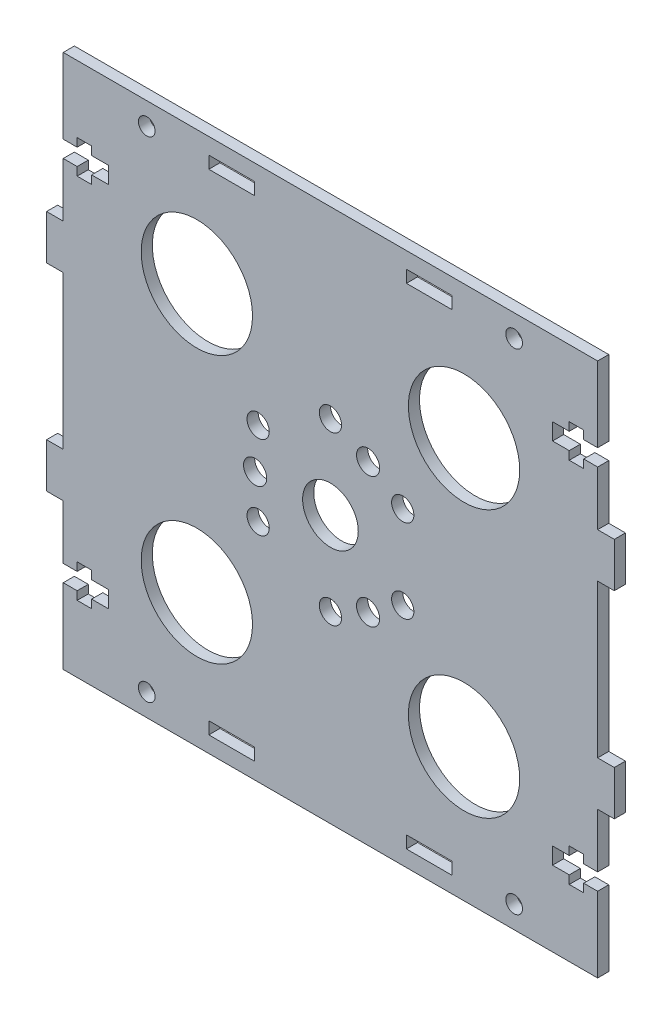
from build123d import *

# Parameters (mm, degrees)
SKETCH_1_R      = 1.5
SKETCH_1_R_2    = 2
SKETCH_1_R_3    = 2.08
SKETCH_1_R_4    = 5
SKETCH_1_R_5    = 10
SKETCH_1_W      = 8.2
SKETCH_1_H      = 2.2
EXTRUDE_1_DEPTH = 2


with BuildPart() as part:
    # 草图1 → 凸台-拉伸1 (new body)
    with BuildSketch(Plane.XY):
        Polygon((-50.266155614, -92.324512395), (-50.266155614, -102.074512395), (-47.766155614, -102.074512395), (-47.766155614, -100.574512395), (-45.166155614, -100.574512395), (-45.166155614, -102.074512395), (-42.166155614, -102.074512395), (-42.166155614, -105.074512395), (-45.166155614, -105.074512395), (-45.166155614, -106.574512395), (-47.766155614, -106.574512395), (-47.766155614, -105.074512395), (-50.266155614, -105.074512395), (-50.266155614, -106.074512395), (-50.266155614, -118.574512395), (-2.266155614, -118.574512395), (45.733844386, -118.574512395), (45.733844386, -106.074512395), (45.733844386, -105.074512395), (43.233844386, -105.074512395), (43.233844386, -106.574512395), (40.633844386, -106.574512395), (40.633844386, -105.074512395), (37.633844386, -105.074512395), (37.633844386, -102.074512395), (40.633844386, -102.074512395), (40.633844386, -100.574512395), (43.233844386, -100.574512395), (43.233844386, -102.074512395), (45.733844386, -102.074512395), (45.733844386, -92.324512395), (48.733844386, -92.324512395), (48.733844386, -84.324512395), (45.733844386, -84.324512395), (45.733844386, -56.824512395), (48.733844386, -56.824512395), (48.733844386, -48.824512395), (45.733844386, -48.824512395), (45.733844386, -39.074512395), (43.233844386, -39.074512395), (43.233844386, -40.574512395), (40.633844386, -40.574512395), (40.633844386, -39.074512395), (37.633844386, -39.074512395), (37.633844386, -36.074512395), (40.633844386, -36.074512395), (40.633844386, -34.574512395), (43.233844386, -34.574512395), (43.233844386, -36.074512395), (45.733844386, -36.074512395), (45.733844386, -23.574512395), (45.733844386, -22.574512395), (-2.266155614, -22.574512395), (-50.266155614, -22.574512395), (-50.266155614, -23.574512395), (-50.266155614, -36.074512395), (-47.766155614, -36.074512395), (-47.766155614, -34.574512395), (-45.166155614, -34.574512395), (-45.166155614, -36.074512395), (-42.166155614, -36.074512395), (-42.166155614, -39.074512395), (-45.166155614, -39.074512395), (-45.166155614, -40.574512395), (-47.766155614, -40.574512395), (-47.766155614, -39.074512395), (-50.266155614, -39.074512395), (-50.266155614, -48.824512395), (-53.266155614, -48.824512395), (-53.266155614, -56.824512395), (-50.266155614, -56.824512395), (-50.266155614, -84.324512395), (-53.266155614, -84.324512395), (-53.266155614, -92.324512395), align=None)
        with Locations((-35.266155614, -114.574512396)):
            Circle(SKETCH_1_R, mode=Mode.SUBTRACT)
        with Locations(Location((30.733844386, -114.574512396, 0), (0, 0, 180))):
            Circle(SKETCH_1_R, mode=Mode.SUBTRACT)
        with Locations((30.733844386, -26.574512395)):
            Circle(SKETCH_1_R, mode=Mode.SUBTRACT)
        with Locations(Location((-35.266155614, -26.574512395, 0), (0, 0, 180))):
            Circle(SKETCH_1_R, mode=Mode.SUBTRACT)
        with Locations((-2.266155614, -85.571739483)):
            Circle(SKETCH_1_R_2, mode=Mode.SUBTRACT)
        with Locations((-15.254135258, -78.073125939)):
            Circle(SKETCH_1_R_2, mode=Mode.SUBTRACT)
        with Locations((-15.254135258, -63.075898852)):
            Circle(SKETCH_1_R_2, mode=Mode.SUBTRACT)
        with Locations((-2.266155614, -55.577285308)):
            Circle(SKETCH_1_R_2, mode=Mode.SUBTRACT)
        with Locations((10.721824031, -63.075898852)):
            Circle(SKETCH_1_R_2, mode=Mode.SUBTRACT)
        with Locations((10.721824031, -78.073125939)):
            Circle(SKETCH_1_R_2, mode=Mode.SUBTRACT)
        with Locations((-15.796155614, -70.574512395)):
            Circle(SKETCH_1_R_3, mode=Mode.SUBTRACT)
        with Locations((4.498844386, -58.857188682)):
            Circle(SKETCH_1_R_3, mode=Mode.SUBTRACT)
        with Locations((4.498844386, -82.291836109)):
            Circle(SKETCH_1_R_3, mode=Mode.SUBTRACT)
        with Locations((-2.266155614, -70.574512395)):
            Circle(SKETCH_1_R_4, mode=Mode.SUBTRACT)
        with Locations((-26.266155614, -46.574512395)):
            Circle(SKETCH_1_R_5, mode=Mode.SUBTRACT)
        with Locations((21.733844386, -46.574512395)):
            Circle(SKETCH_1_R_5, mode=Mode.SUBTRACT)
        with Locations((21.733844386, -94.574512395)):
            Circle(SKETCH_1_R_5, mode=Mode.SUBTRACT)
        with Locations((-26.266155614, -94.574512395)):
            Circle(SKETCH_1_R_5, mode=Mode.SUBTRACT)
        with Locations((-20.016155614, -114.574512396)):
            Rectangle(SKETCH_1_W, SKETCH_1_H, mode=Mode.SUBTRACT)
        with Locations((15.483844386, -114.574512396)):
            Rectangle(SKETCH_1_W, SKETCH_1_H, mode=Mode.SUBTRACT)
        with Locations((15.483844386, -26.574512395)):
            Rectangle(SKETCH_1_W, SKETCH_1_H, mode=Mode.SUBTRACT)
        with Locations((-20.016155614, -26.574512395)):
            Rectangle(SKETCH_1_W, SKETCH_1_H, mode=Mode.SUBTRACT)
    extrude(amount=EXTRUDE_1_DEPTH)


solid = part.part
